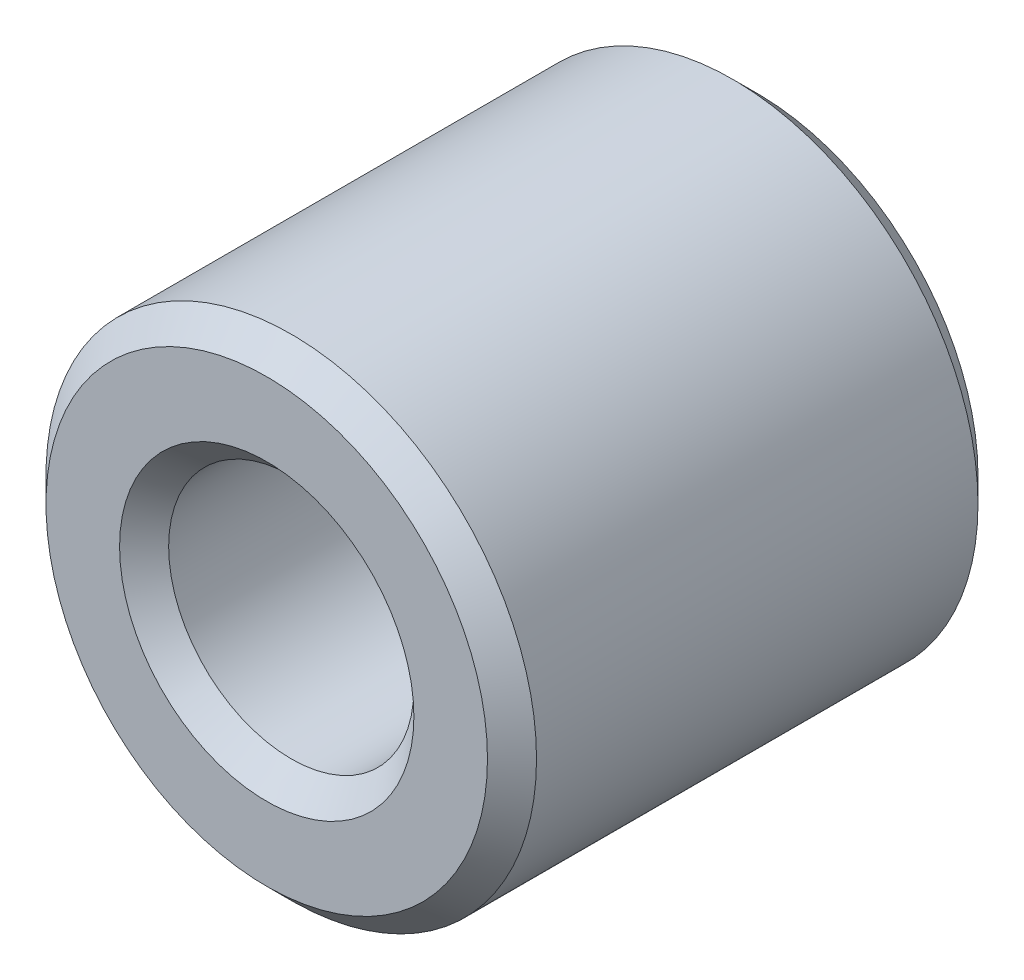
from build123d import *

# Parameters (mm, degrees)
CROQUIS1_R              = 3
CROQUIS1_R_2            = 1.5
SALIENTE_EXTRUIR1_DEPTH = 6
CHAFL_N1_SIZE           = 0.3


with BuildPart() as part:
    # Croquis1 → Saliente-Extruir1 (new body)
    with BuildSketch(Plane.XY):
        Circle(CROQUIS1_R)
        Circle(CROQUIS1_R_2, mode=Mode.SUBTRACT)
    extrude(amount=SALIENTE_EXTRUIR1_DEPTH)

    # Chaflán1
    chafl_n1_edges = [part.edges().sort_by_distance(p)[0] for p in [
        (-3, 0, 0),
        (-3, 0, 6),
        (-1.5, 0, 0),
        (-1.5, 0, 6),
    ]]
    chamfer(chafl_n1_edges, length=CHAFL_N1_SIZE)


solid = part.part
